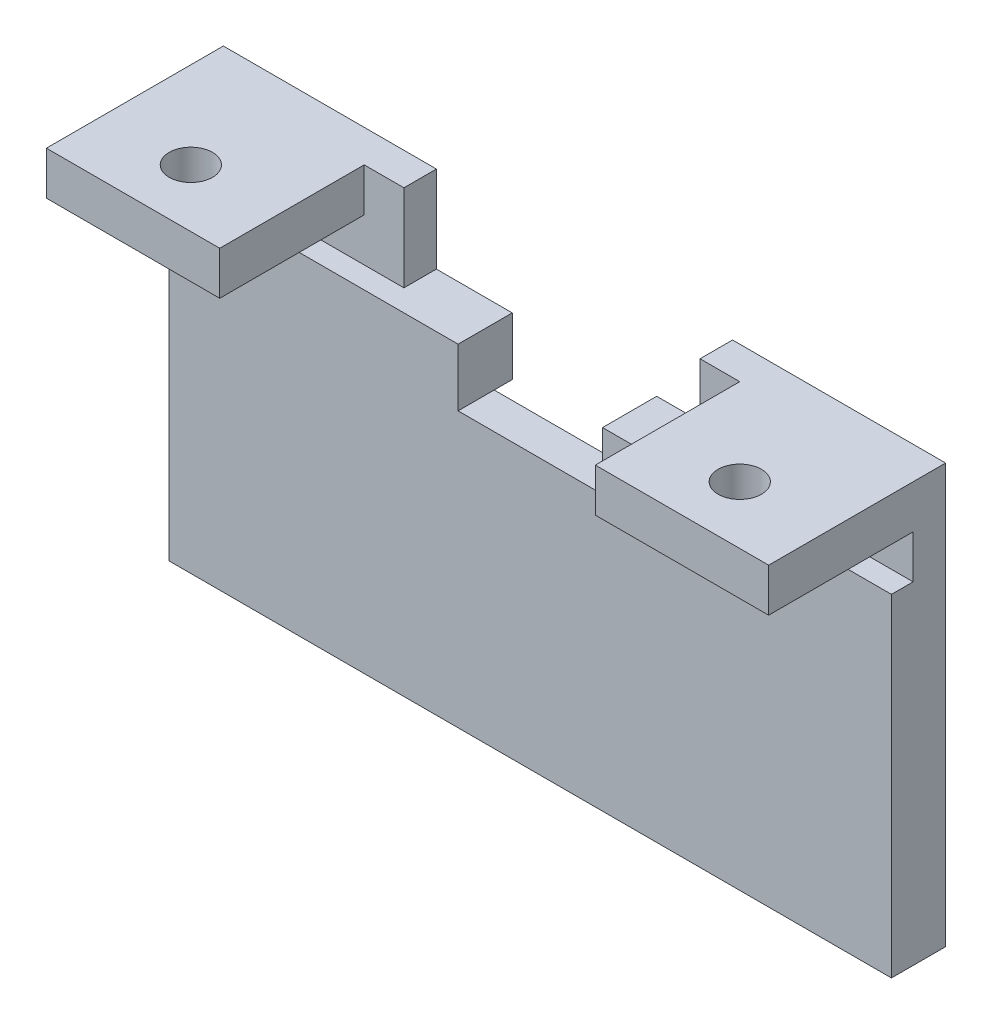
from build123d import *

# Parameters (mm, degrees)
BOSS_EXTRUDE1_DEPTH = 2.25
SKETCH2_W           = 12
SKETCH2_H           = 10
SKETCH2_R           = 1.5
BOSS_EXTRUDE3_DEPTH = 3
SKETCH3_W           = 5
SKETCH3_H           = 1
CUT_EXTRUDE1_DEPTH  = 19
SKETCH4_W           = 50
SKETCH4_H           = 23
BOSS_EXTRUDE5_DEPTH = 1.5
SKETCH5_W           = 10
SKETCH5_H           = 3.75
CUT_EXTRUDE2_DEPTH  = 4
SKETCH7_W           = 12
SKETCH7_H           = 2
BOSS_EXTRUDE6_DEPTH = 5
BOSS_EXTRUDE7_START = -1
SKETCH8_W           = 17
SKETCH8_H           = 2
BOSS_EXTRUDE7_DEPTH = 2.25


with BuildPart() as part:
    # Sketch1 → Boss-Extrude1 (new body)
    with BuildSketch(Plane.XY):
        Polygon((25, -11.5), (-25, -11.5), (-25, 11.5), (-25, 17.5), (-10.25, 17.5), (-10.25, 11.5), (10.25, 11.5), (10.25, 17.5), (25, 17.5), (25, 11.5), align=None)
    extrude(amount=BOSS_EXTRUDE1_DEPTH)

    # Sketch2 → Boss-Extrude3 (add)
    # profile 1 of 2: a face of its own
    with BuildSketch(Plane(origin=(0, 17.5, 0), x_dir=(1, 0, 0), z_dir=(0, 1, 0))):
        with Locations((19, -7.25)):
            Rectangle(SKETCH2_W, SKETCH2_H)
        with Locations(Location((19, -8.25, 0), (0, 0, 270))):
            Circle(SKETCH2_R, mode=Mode.SUBTRACT)
    # profile 2 of 2: a face of its own
    with BuildSketch(Plane(origin=(0, 17.5, 0), x_dir=(1, 0, 0), z_dir=(0, 1, 0))):
        with Locations((-19, -7.25)):
            Rectangle(SKETCH2_W, SKETCH2_H)
        with Locations(Location((-19, -8.25, 0), (0, 0, 90))):
            Circle(SKETCH2_R, mode=Mode.SUBTRACT)
    extrude(amount=-BOSS_EXTRUDE3_DEPTH)

    # Sketch3 → Cut-Extrude1 (cut)
    with BuildSketch(Plane.XZ.offset(11.5)):
        Polygon((-23, 1.25), (-23, 0), (23, 0), (23, 1.25), (16, 1.25), (11, 1.25), (-11, 1.25), (-16, 1.25), align=None)
        with Locations((-13.5, 1.75)):
            Rectangle(SKETCH3_W, SKETCH3_H)
        with Locations((13.5, 1.75)):
            Rectangle(SKETCH3_W, SKETCH3_H)
    extrude(amount=-CUT_EXTRUDE1_DEPTH, mode=Mode.SUBTRACT)

    # Sketch4 → Boss-Extrude5 (add)
    with BuildSketch(Plane.XY.offset(2.25)):
        Rectangle(SKETCH4_W, SKETCH4_H)
    extrude(amount=BOSS_EXTRUDE5_DEPTH)

    # Sketch5 → Cut-Extrude2 (cut)
    with BuildSketch(Plane(origin=(0, 11.5, 0), x_dir=(1, 0, 0), z_dir=(0, 1, 0))):
        with Locations((0, -1.875)):
            Rectangle(SKETCH5_W, SKETCH5_H)
    extrude(amount=-CUT_EXTRUDE2_DEPTH, mode=Mode.SUBTRACT)

    # Sketch7 → Boss-Extrude6 (add)
    with BuildSketch(Plane(origin=(0, 0, 1.25), x_dir=(-1, 0, 0), z_dir=(0, 0, -1))):
        with Locations((0, -10.5)):
            Rectangle(SKETCH7_W, SKETCH7_H)
    extrude(amount=BOSS_EXTRUDE6_DEPTH)

    # Sketch8 → Boss-Extrude7 (add)
    with BuildSketch(Plane(origin=(0, 0, 1.25), x_dir=(-1, 0, 0), z_dir=(0, 0, -1)).offset(BOSS_EXTRUDE7_START)):
        with Locations((14.5, -10.5)):
            Rectangle(SKETCH8_W, SKETCH8_H)
        with Locations((-14.5, -10.5)):
            Rectangle(SKETCH8_W, SKETCH8_H)
    extrude(amount=BOSS_EXTRUDE7_DEPTH)


solid = part.part
